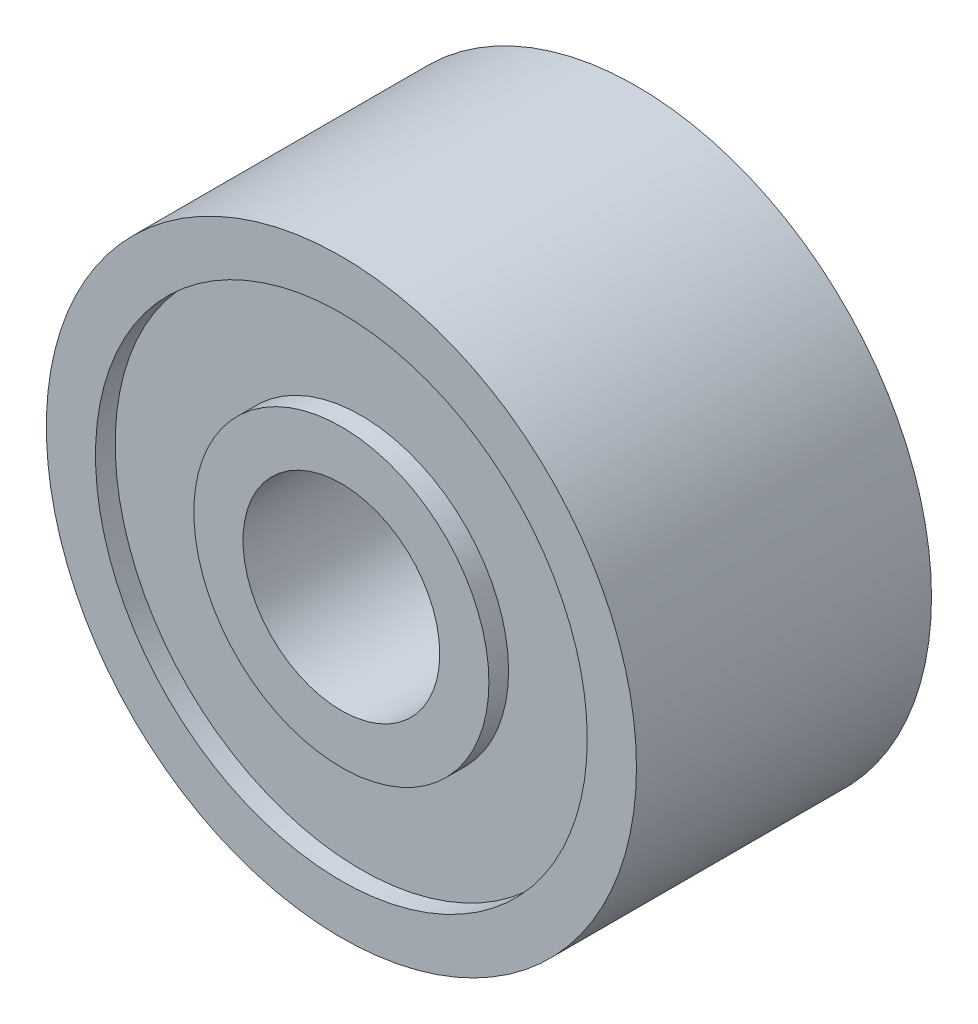
from build123d import *

# Parameters (mm, degrees)
SKETCH1_R           = 3
SKETCH1_R_2         = 1
BOSS_EXTRUDE1_DEPTH = 1.5
SKETCH2_R           = 2.5
SKETCH2_R_2         = 1.5
CUT_EXTRUDE1_DEPTH  = 0.2
CUT_EXTRUDE2_START  = -2.8
SKETCH2_2_R         = 2.5
SKETCH2_2_R_2       = 1.5
CUT_EXTRUDE2_DEPTH  = 0.2


with BuildPart() as part:
    # Sketch1 → Boss-Extrude1 (new, symmetric)
    with BuildSketch(Plane.XY):
        Circle(SKETCH1_R)
        Circle(SKETCH1_R_2, mode=Mode.SUBTRACT)
    extrude(amount=BOSS_EXTRUDE1_DEPTH, both=True)

    # Sketch2 → Cut-Extrude1 (cut)
    with BuildSketch(Plane.XY.offset(1.5)):
        Circle(SKETCH2_R)
        Circle(SKETCH2_R_2, mode=Mode.SUBTRACT)
    extrude(amount=-CUT_EXTRUDE1_DEPTH, mode=Mode.SUBTRACT)

    # Sketch2<2> → Cut-Extrude2 (cut)
    with BuildSketch(Plane.XY.offset(1.5).offset(CUT_EXTRUDE2_START)):
        Circle(SKETCH2_2_R)
        Circle(SKETCH2_2_R_2, mode=Mode.SUBTRACT)
    extrude(amount=-CUT_EXTRUDE2_DEPTH, mode=Mode.SUBTRACT)


solid = part.part
